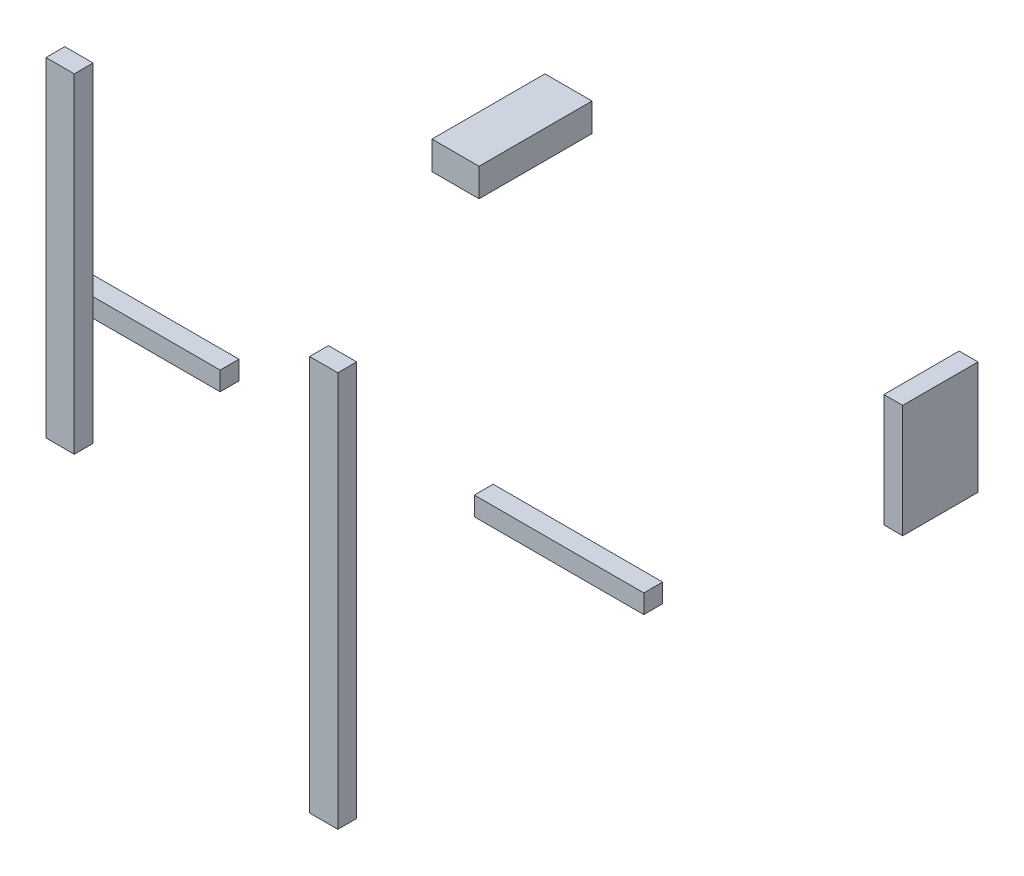
from build123d import *

# Parameters (mm, degrees)
SENSOR_START                                = 36
SKETCH_1_W                                  = 3
SKETCH_1_H                                  = 42
SENSOR_CABLE_HC_SR04_TO_ESP32_DEPTH         = 2
SERVO_START                                 = 46
SKETCH_2_W                                  = 3
SKETCH_2_H                                  = 35
SERVO_PWM_CABLE_SG90_TO_ESP32_DEPTH         = 2
LED_START                                   = 35
SKETCH_3_W                                  = 18
SKETCH_3_H                                  = 2
LED_DATA_CABLE_WS2812_TO_ESP32_DEPTH        = 2
BUZZER_START                                = 33
SKETCH_4_W                                  = 18
SKETCH_4_H                                  = 2
BUZZER_SIGNAL_CABLE_BUZZER_TO_ESP32_DEPTH   = 2
F_5V_START                                  = 12
SKETCH_5_W                                  = 5
SKETCH_5_H                                  = 3
F_5V_POWER_LEADS_BATTERY_TO_MAIN_RAIL_DEPTH = 12
USB_START                                   = 20
SKETCH_6_W                                  = 2
SKETCH_6_H                                  = 12
USB_SIDE_EXIT_CLEARANCE_MARKER_DEPTH        = 8


with BuildPart() as part:
    # 草图1 → sensor cable: HC-SR04 to ESP32 (new body)
    with BuildSketch(Plane.XY.offset(SENSOR_START)):
        with Locations((0, -26)):
            Rectangle(SKETCH_1_W, SKETCH_1_H)
    extrude(amount=SENSOR_CABLE_HC_SR04_TO_ESP32_DEPTH)


with BuildPart() as body_2:
    # 草图2 → servo PWM cable: SG90 to ESP32 (new body)
    with BuildSketch(Plane.XY.offset(SERVO_START)):
        with Locations((-18, 1)):
            Rectangle(SKETCH_2_W, SKETCH_2_H)
    extrude(amount=SERVO_PWM_CABLE_SG90_TO_ESP32_DEPTH)


with BuildPart() as body_3:
    # 草图3 → LED data cable: WS2812 to ESP32 (new body)
    with BuildSketch(Plane.XY.offset(LED_START)):
        with Locations((-21, -13)):
            Rectangle(SKETCH_3_W, SKETCH_3_H)
    extrude(amount=LED_DATA_CABLE_WS2812_TO_ESP32_DEPTH)


with BuildPart() as body_4:
    # 草图4 → buzzer signal cable: buzzer to ESP32 (new body)
    with BuildSketch(Plane.XY.offset(BUZZER_START)):
        with Locations((22, -13)):
            Rectangle(SKETCH_4_W, SKETCH_4_H)
    extrude(amount=BUZZER_SIGNAL_CABLE_BUZZER_TO_ESP32_DEPTH)


with BuildPart() as body_5:
    # 草图5 → 5V power leads: battery to main rail (new body)
    with BuildSketch(Plane.XY.offset(F_5V_START)):
        with Locations((0, 6)):
            Rectangle(SKETCH_5_W, SKETCH_5_H)
    extrude(amount=F_5V_POWER_LEADS_BATTERY_TO_MAIN_RAIL_DEPTH)


with BuildPart() as body_6:
    # 草图6 → USB side exit clearance marker (new body)
    with BuildSketch(Plane.XY.offset(USB_START)):
        with Locations((50.5, 6)):
            Rectangle(SKETCH_6_W, SKETCH_6_H)
    extrude(amount=USB_SIDE_EXIT_CLEARANCE_MARKER_DEPTH)


solid = Compound([part.part, body_2.part, body_3.part, body_4.part, body_5.part, body_6.part])
